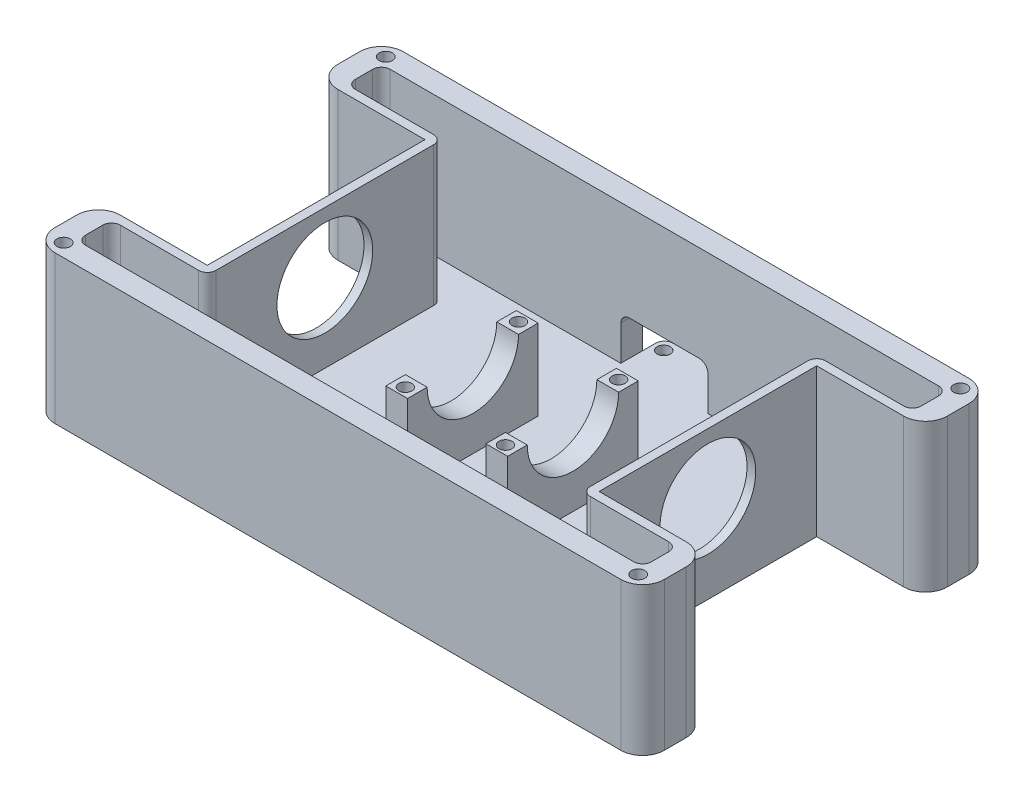
from build123d import *

# Parameters (mm, degrees)
SKETCH1_W           = 177.8
SKETCH1_H           = 101.6
BOSS_EXTRUDE1_DEPTH = 2.54
SKETCH2_W           = 25.4
SKETCH2_H           = 63.5
CUT_EXTRUDE1_DEPTH  = 2.54
SKETCH3_W           = 177.8
SKETCH3_H           = 101.6
SKETCH3_W_2         = 165.1
SKETCH3_H_2         = 88.9
BOSS_EXTRUDE2_DEPTH = 40.64
BOSS_EXTRUDE3_DEPTH = 40.64
SKETCH8_W           = 6.35
SKETCH8_H           = 38.1
BOSS_EXTRUDE4_DEPTH = 10.16
BOSS_EXTRUDE5_DEPTH = 6.35
SKETCH10_W          = 6.35
SKETCH10_H          = 63.5
CUT_EXTRUDE2_DEPTH  = 107.696
SKETCH11_R          = 13.97
CUT_EXTRUDE5_DEPTH  = 2.54
FILLET1_R           = 6.35
FILLET2_R           = 2.54
SKETCH14_W          = 25.4
SKETCH14_H          = 6.35
BOSS_EXTRUDE6_DEPTH = 2.54
SKETCH15_R          = 1.905
CUT_EXTRUDE6_DEPTH  = 8.636
FILLET3_R           = 2.54
SKETCH16_R          = 1.95
CUT_EXTRUDE7_DEPTH  = 10
SKETCH17_R          = 1.905
CUT_EXTRUDE8_DEPTH  = 10
SKETCH18_W          = 25.4
SKETCH18_H          = 12.7
CUT_EXTRUDE9_DEPTH  = 10
FILLET4_R           = 2.54


with BuildPart() as part:
    # Sketch1 → Boss-Extrude1 (new body)
    with BuildSketch(Plane(origin=(0, 0, 0), x_dir=(1, 0, 0), z_dir=(0, 1, 0))):
        Rectangle(SKETCH1_W, SKETCH1_H)
    extrude(amount=BOSS_EXTRUDE1_DEPTH)

    # Sketch2 → Cut-Extrude1 (cut)
    with BuildSketch(Plane(origin=(0, 2.54, 0), x_dir=(1, 0, 0), z_dir=(0, 1, 0))):
        with Locations((-69.85, 0)):
            Rectangle(SKETCH2_W, SKETCH2_H)
        with Locations((69.85, 0)):
            Rectangle(SKETCH2_W, SKETCH2_H)
    extrude(amount=-CUT_EXTRUDE1_DEPTH, mode=Mode.SUBTRACT)

    # Sketch3 → Boss-Extrude2 (add)
    with BuildSketch(Plane(origin=(0, 2.54, 0), x_dir=(1, 0, 0), z_dir=(0, 1, 0))):
        Rectangle(SKETCH3_W, SKETCH3_H)
        Rectangle(SKETCH3_W_2, SKETCH3_H_2, mode=Mode.SUBTRACT)
    extrude(amount=BOSS_EXTRUDE2_DEPTH)

    # Sketch7 → Boss-Extrude3 (add)
    with BuildSketch(Plane(origin=(0, 2.54, 0), x_dir=(1, 0, 0), z_dir=(0, 1, 0))):
        Polygon((-54.61, 34.29), (-82.55, 34.29), (-82.55, 31.75), (-57.15, 31.75), (-57.15, -31.75), (-82.55, -31.75), (-82.55, -34.29), (-54.61, -34.29), align=None)
        Polygon((82.55, 34.29), (54.61, 34.29), (54.61, -34.29), (82.55, -34.29), (82.55, -31.75), (57.15, -31.75), (57.15, 31.75), (82.55, 31.75), align=None)
    extrude(amount=BOSS_EXTRUDE3_DEPTH)

    # Sketch8 → Boss-Extrude4 (add)
    with BuildSketch(Plane(origin=(0, 2.54, 0), x_dir=(1, 0, 0), z_dir=(0, 1, 0))):
        with Locations((-14.605, 0)):
            Rectangle(SKETCH8_W, SKETCH8_H)
    boss_extrude4 = extrude(amount=BOSS_EXTRUDE4_DEPTH)

    # Sketch9 → Boss-Extrude5 (add)
    with BuildSketch(Plane(origin=(-11.43, 0, 0), x_dir=(0, 0, -1), z_dir=(1, 0, 0))):
        with BuildLine():
            Line((-19.05, 26.035), (-19.05, 12.7))
            Line((-19.05, 12.7), (7e-09, 12.7))
            ThreePointArc((7e-09, 12.7), (-9.429268925, 16.60573107), (-13.335, 26.035))
            Line((-13.335, 26.035), (-19.05, 26.035))
        make_face()
        with BuildLine():
            ThreePointArc((13.335, 26.035), (9.42926893, 16.605731075), (7e-09, 12.7))
            Line((7e-09, 12.7), (19.05, 12.7))
            Line((19.05, 12.7), (19.05, 26.035))
            Line((19.05, 26.035), (13.335, 26.035))
        make_face()
    boss_extrude5 = extrude(amount=-BOSS_EXTRUDE5_DEPTH)

    # Sketch10 → Cut-Extrude2 (cut)
    with BuildSketch(Plane(origin=(0, 43.18, 0), x_dir=(1, 0, 0), z_dir=(0, 1, 0))):
        with Locations((-85.725, 0)):
            Rectangle(SKETCH10_W, SKETCH10_H)
        with Locations((85.725, 0)):
            Rectangle(SKETCH10_W, SKETCH10_H)
    extrude(amount=-CUT_EXTRUDE2_DEPTH, mode=Mode.SUBTRACT)

    # Mirror1: Boss-Extrude4, Boss-Extrude5 across plane
    add(boss_extrude4.mirror(Plane(origin=(0, 0, 0), x_dir=(0, 0, 1), z_dir=(1, 0, 0))))
    add(boss_extrude5.mirror(Plane(origin=(0, 0, 0), x_dir=(0, 0, 1), z_dir=(1, 0, 0))))

    # Sketch11 → Cut-Extrude5 (cut)
    with BuildSketch(Plane.ZY.offset(-54.61)):
        with Locations((0, 25.4)):
            Circle(SKETCH11_R)
    cut_extrude5 = extrude(amount=-CUT_EXTRUDE5_DEPTH, mode=Mode.SUBTRACT)

    # Mirror2: Cut-Extrude5 across plane
    add(cut_extrude5.mirror(Plane(origin=(0, 0, 0), x_dir=(0, 0, 1), z_dir=(1, 0, 0))), mode=Mode.SUBTRACT)

    # Fillet1
    fillet1_edges = [part.edges().sort_by_distance(p)[0] for p in [
        (-88.9, 21.59, 31.75),
        (-88.9, 21.59, -31.75),
        (88.9, 21.59, -31.75),
        (88.9, 21.59, 31.75),
        (88.9, 21.59, 50.8),
        (-88.9, 21.59, 50.8),
        (-88.9, 21.59, -50.8),
        (88.9, 21.59, -50.8),
    ]]
    fillet(fillet1_edges, radius=FILLET1_R)

    # Fillet2
    fillet2_edges = [part.edges().sort_by_distance(p)[0] for p in [
        (82.55, 22.86, -34.29),
        (-82.55, 22.86, 44.45),
        (82.55, 22.86, 44.45),
        (82.55, 22.86, -44.45),
        (-82.55, 22.86, -44.45),
        (-54.61, 22.86, 34.29),
        (-54.61, 22.86, -34.29),
        (-82.55, 22.86, -34.29),
        (-82.55, 22.86, 34.29),
        (54.61, 22.86, -34.29),
        (54.61, 22.86, 34.29),
        (82.55, 22.86, 34.29),
    ]]
    fillet(fillet2_edges, radius=FILLET2_R)

    # Sketch14 → Boss-Extrude6 (add)
    with BuildSketch(Plane(origin=(0, 2.54, 0), x_dir=(1, 0, 0), z_dir=(0, 1, 0))):
        with Locations((0, 53.975)):
            Rectangle(SKETCH14_W, SKETCH14_H)
    extrude(amount=-BOSS_EXTRUDE6_DEPTH)

    # Sketch15 → Cut-Extrude6 (cut)
    with BuildSketch(Plane(origin=(0, 2.54, 0), x_dir=(1, 0, 0), z_dir=(0, 1, 0))):
        with Locations(Location((-9.7, 53.975, 0), (0, 0, 270))):
            Circle(SKETCH15_R)
        with Locations(Location((9.7, 53.975, 0), (0, 0, 270))):
            Circle(SKETCH15_R)
    extrude(amount=-CUT_EXTRUDE6_DEPTH, mode=Mode.SUBTRACT)

    # Fillet3
    fillet3_edges = [part.edges().sort_by_distance(p)[0] for p in [
        (-12.7, 1.27, -57.15),
        (12.7, 1.27, -57.15),
    ]]
    fillet(fillet3_edges, radius=FILLET3_R)

    # Sketch16 → Cut-Extrude7 (cut)
    with BuildSketch(Plane(origin=(0, 43.18, 0), x_dir=(1, 0, 0), z_dir=(0, 1, 0))):
        with Locations(Location((-83.82, 46.99, 0), (0, 0, 270))):
            Circle(SKETCH16_R)
        with Locations(Location((83.82, 46.99, 0), (0, 0, 270))):
            Circle(SKETCH16_R)
        with Locations(Location((83.82, -46.99, 0), (0, 0, 270))):
            Circle(SKETCH16_R)
        with Locations(Location((-83.82, -46.99, 0), (0, 0, 270))):
            Circle(SKETCH16_R)
    extrude(amount=-CUT_EXTRUDE7_DEPTH, mode=Mode.SUBTRACT)

    # Sketch17 → Cut-Extrude8 (cut)
    with BuildSketch(Plane(origin=(0, 26.035, 0), x_dir=(1, 0, 0), z_dir=(0, 1, 0))):
        with Locations(Location((-14.605, 16.51, 0), (0, 0, 270))):
            Circle(SKETCH17_R)
        with Locations(Location((14.605, 16.51, 0), (0, 0, 270))):
            Circle(SKETCH17_R)
        with Locations(Location((14.605, -16.51, 0), (0, 0, 270))):
            Circle(SKETCH17_R)
        with Locations(Location((-14.605, -16.51, 0), (0, 0, 270))):
            Circle(SKETCH17_R)
    extrude(amount=-CUT_EXTRUDE8_DEPTH, mode=Mode.SUBTRACT)

    # Sketch18 → Cut-Extrude9 (cut)
    with BuildSketch(Plane(origin=(0, 0, -50.8), x_dir=(-1, 0, 0), z_dir=(0, 0, -1))):
        with Locations((0, 8.89)):
            Rectangle(SKETCH18_W, SKETCH18_H)
    extrude(amount=-CUT_EXTRUDE9_DEPTH, mode=Mode.SUBTRACT)

    # Fillet4
    fillet4_edges = [part.edges().sort_by_distance(p)[0] for p in [
        (12.7, 15.24, -47.625),
        (-12.7, 15.24, -47.625),
    ]]
    fillet(fillet4_edges, radius=FILLET4_R)


solid = part.part
